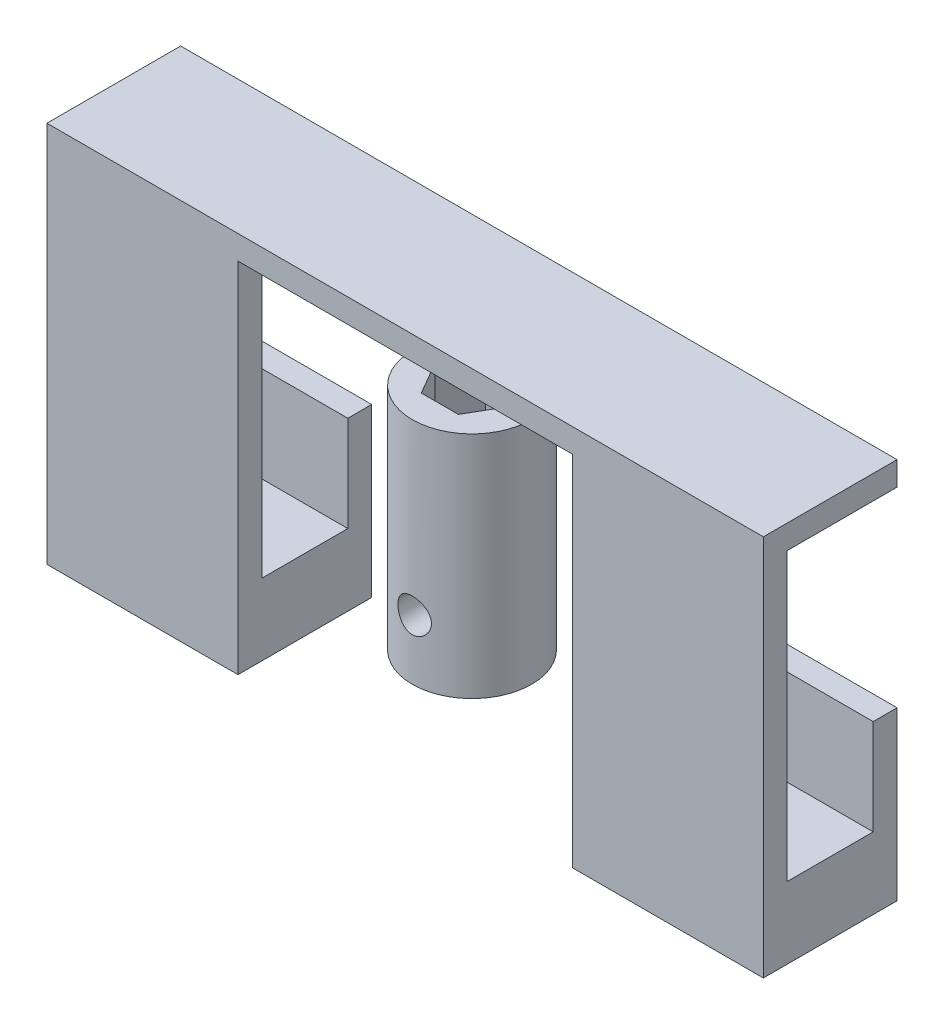
from build123d import *

# Parameters (mm, degrees)
SKETCH2_W           = 20
SKETCH2_H           = 14
BOSS_EXTRUDE1_DEPTH = 7.5
SKETCH4_W           = 20
SKETCH4_H           = 2.5
BOSS_EXTRUDE2_DEPTH = 10
SKETCH6_W           = 20
SKETCH6_H           = 2.5
BOSS_EXTRUDE3_DEPTH = 30
SKETCH8_W           = 20
SKETCH8_H           = 14
BOSS_EXTRUDE4_DEPTH = 7.5
SKETCH9_W           = 20
SKETCH9_H           = 2.5
BOSS_EXTRUDE5_DEPTH = 10
SKETCH10_W          = 20
SKETCH10_H          = 2.5
BOSS_EXTRUDE6_DEPTH = 30
SKETCH11_W          = 75
SKETCH11_H          = 14
BOSS_EXTRUDE7_DEPTH = 2.5
BOSS_EXTRUDE8_START = -32.5
SKETCH12_R          = 6.25
BOSS_EXTRUDE8_DEPTH = 24
SKETCH13_R          = 1.752036184
CUT_EXTRUDE1_DEPTH  = 52.560643906


with BuildPart() as part:
    # Sketch2 → Boss-Extrude1 (new body)
    with BuildSketch(Plane(origin=(0, 0, 0), x_dir=(1, 0, 0), z_dir=(0, 1, 0))):
        with Locations((-27.5, 7)):
            Rectangle(SKETCH2_W, SKETCH2_H)
    extrude(amount=-BOSS_EXTRUDE1_DEPTH)

    # Sketch4 → Boss-Extrude2 (add)
    with BuildSketch(Plane(origin=(0, 0, 0), x_dir=(1, 0, 0), z_dir=(0, 1, 0))):
        with Locations((-27.5, 12.75)):
            Rectangle(SKETCH4_W, SKETCH4_H)
    extrude(amount=BOSS_EXTRUDE2_DEPTH)

    # Sketch6 → Boss-Extrude3 (add)
    with BuildSketch(Plane(origin=(0, 0, 0), x_dir=(1, 0, 0), z_dir=(0, 1, 0))):
        with Locations((-27.5, 1.25)):
            Rectangle(SKETCH6_W, SKETCH6_H)
    extrude(amount=BOSS_EXTRUDE3_DEPTH)



with BuildPart() as body_2:
    # Sketch8 → Boss-Extrude4 (new body)
    with BuildSketch(Plane(origin=(0, 0, 0), x_dir=(1, 0, 0), z_dir=(0, 1, 0))):
        with Locations((27.5, 7)):
            Rectangle(SKETCH8_W, SKETCH8_H)
    extrude(amount=-BOSS_EXTRUDE4_DEPTH)

    # Sketch9 → Boss-Extrude5 (add)
    with BuildSketch(Plane(origin=(0, 0, 0), x_dir=(1, 0, 0), z_dir=(0, 1, 0))):
        with Locations((27.5, 12.75)):
            Rectangle(SKETCH9_W, SKETCH9_H)
    extrude(amount=BOSS_EXTRUDE5_DEPTH)

    # Sketch10 → Boss-Extrude6 (add)
    with BuildSketch(Plane(origin=(0, 0, 0), x_dir=(1, 0, 0), z_dir=(0, 1, 0))):
        with Locations((27.5, 1.25)):
            Rectangle(SKETCH10_W, SKETCH10_H)
    extrude(amount=BOSS_EXTRUDE6_DEPTH)


with BuildPart() as part_1:
    add(part.part)

    add(body_2.part)  # Boss-Extrude7 merges body 2
    # Sketch11 → Boss-Extrude7 (add)
    with BuildSketch(Plane(origin=(0, 30, 0), x_dir=(1, 0, 0), z_dir=(0, 1, 0))):
        with Locations((0, 7)):
            Rectangle(SKETCH11_W, SKETCH11_H)
    extrude(amount=BOSS_EXTRUDE7_DEPTH)


with BuildPart() as body_2_2:
    # Sketch12 → Boss-Extrude8 (new body)
    with BuildSketch(Plane(origin=(0, 32.5, 0), x_dir=(1, 0, 0), z_dir=(0, 1, 0)).offset(BOSS_EXTRUDE8_START)):
        with Locations(Location((0, 7, 0), (0, 0, 270))):
            Circle(SKETCH12_R)
        Polygon((-1.944227031, 10.3675), (-3.888454063, 7), (-1.944227031, 3.6325), (1.944227031, 3.6325), (3.888454063, 7), (1.944227031, 10.3675), align=None, mode=Mode.SUBTRACT)
    extrude(amount=BOSS_EXTRUDE8_DEPTH)

    # Sketch13 → Cut-Extrude1 (cut, through all)
    with BuildSketch(Plane.XY):
        with Locations((0, 6.254)):
            Circle(SKETCH13_R)
    extrude(amount=-CUT_EXTRUDE1_DEPTH, mode=Mode.SUBTRACT)


solid = Compound([part_1.part, body_2_2.part])
